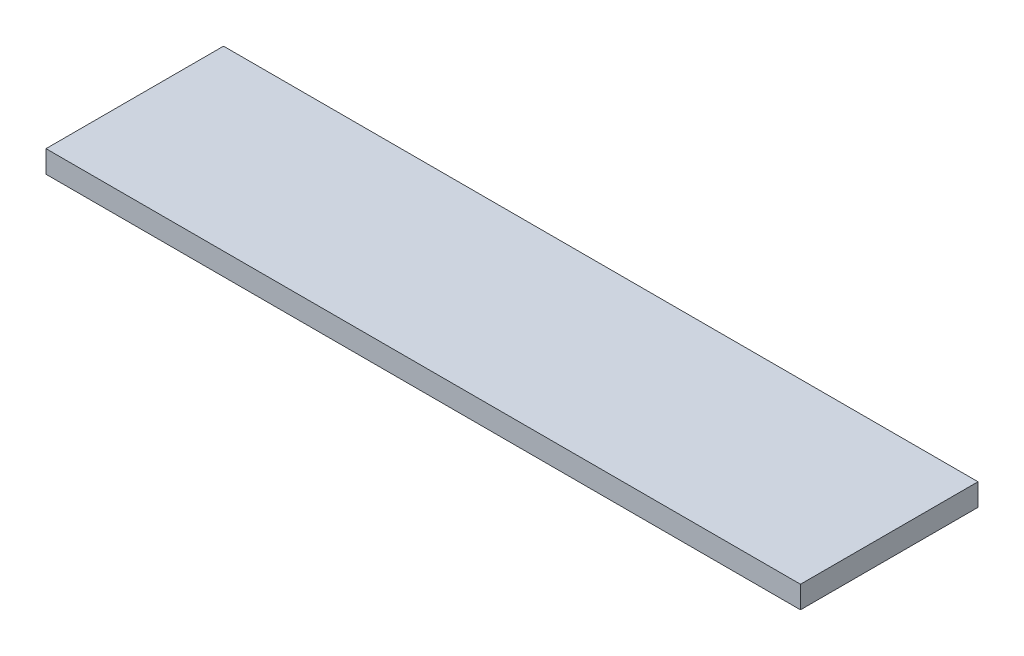
from build123d import *

# Parameters (mm, degrees)
SKETCH1_W           = 170
SKETCH1_H           = 40
BOSS_EXTRUDE1_DEPTH = 5


with BuildPart() as part:
    # Sketch1 → Boss-Extrude1 (new body)
    with BuildSketch(Plane(origin=(0, 0, 0), x_dir=(1, 0, 0), z_dir=(0, 1, 0))):
        Rectangle(SKETCH1_W, SKETCH1_H)
    extrude(amount=BOSS_EXTRUDE1_DEPTH)


solid = part.part
